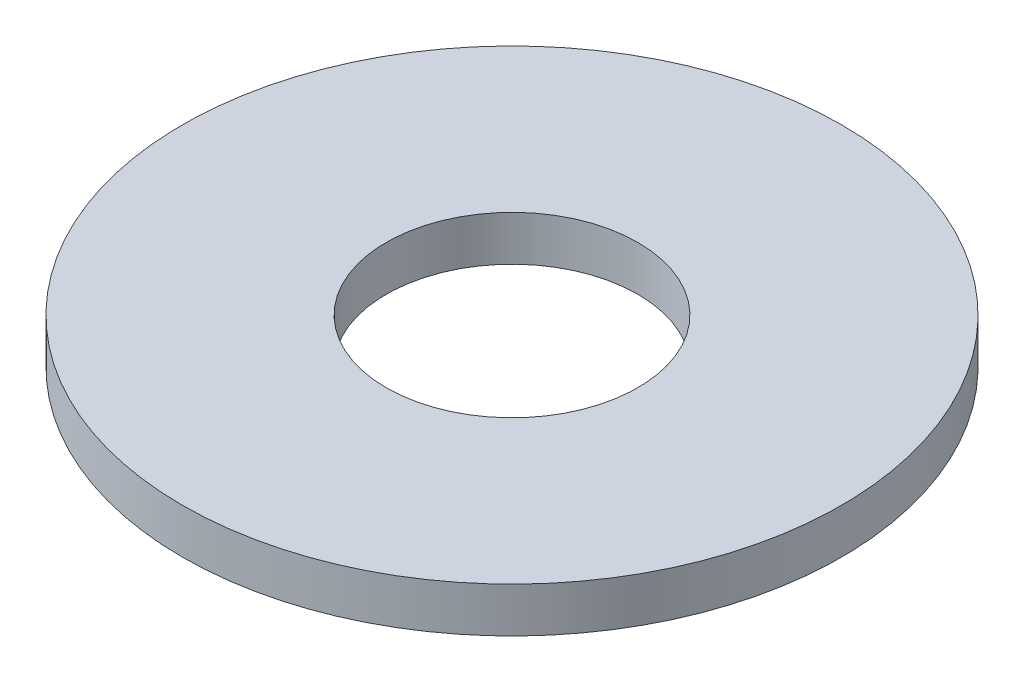
from build123d import *

# Parameters (mm, degrees)
ESQUISSE1_W = 6.8
ESQUISSE1_H = 1.5


with BuildPart() as part:
    # Esquisse1 → Base (revolve)
    with BuildSketch(Plane.XY):
        with Locations((7.6, 0.75)):
            Rectangle(ESQUISSE1_W, ESQUISSE1_H)
    revolve(axis=Axis((0, 0, 0), (0, 1, 0)))


solid = part.part
